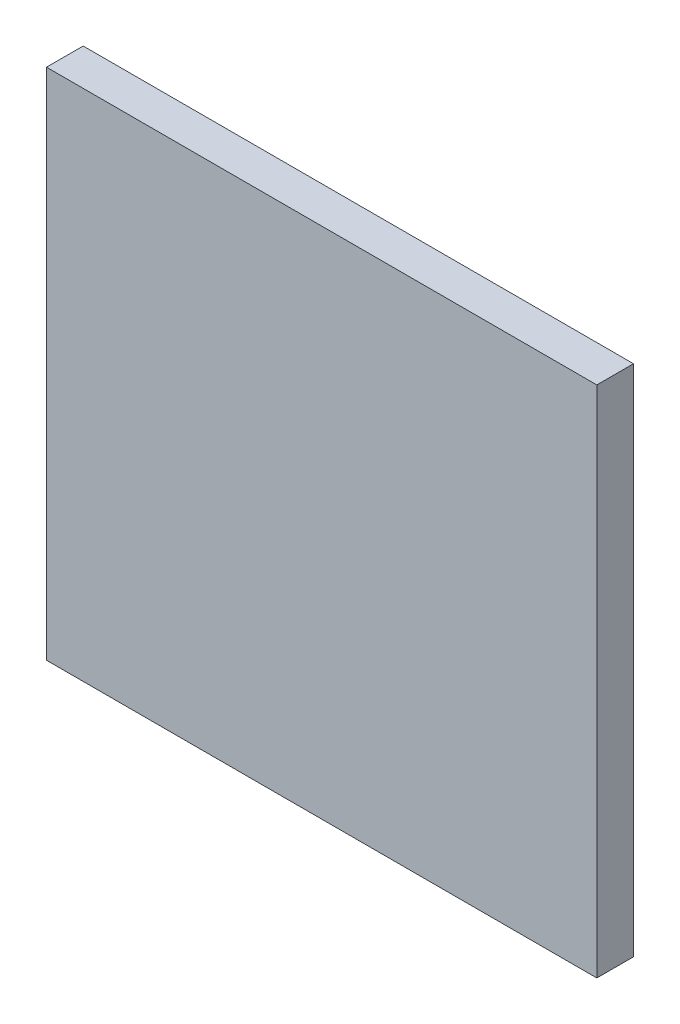
from build123d import *

# Parameters (mm, degrees)
SKETCH_1_W      = 300
SKETCH_1_H      = 280
EXTRUDE_1_DEPTH = 10


with BuildPart() as part:
    # 草图1 → 凸台-拉伸1 (new, symmetric)
    with BuildSketch(Plane.XY):
        Rectangle(SKETCH_1_W, SKETCH_1_H)
    extrude(amount=EXTRUDE_1_DEPTH, both=True)


solid = part.part
